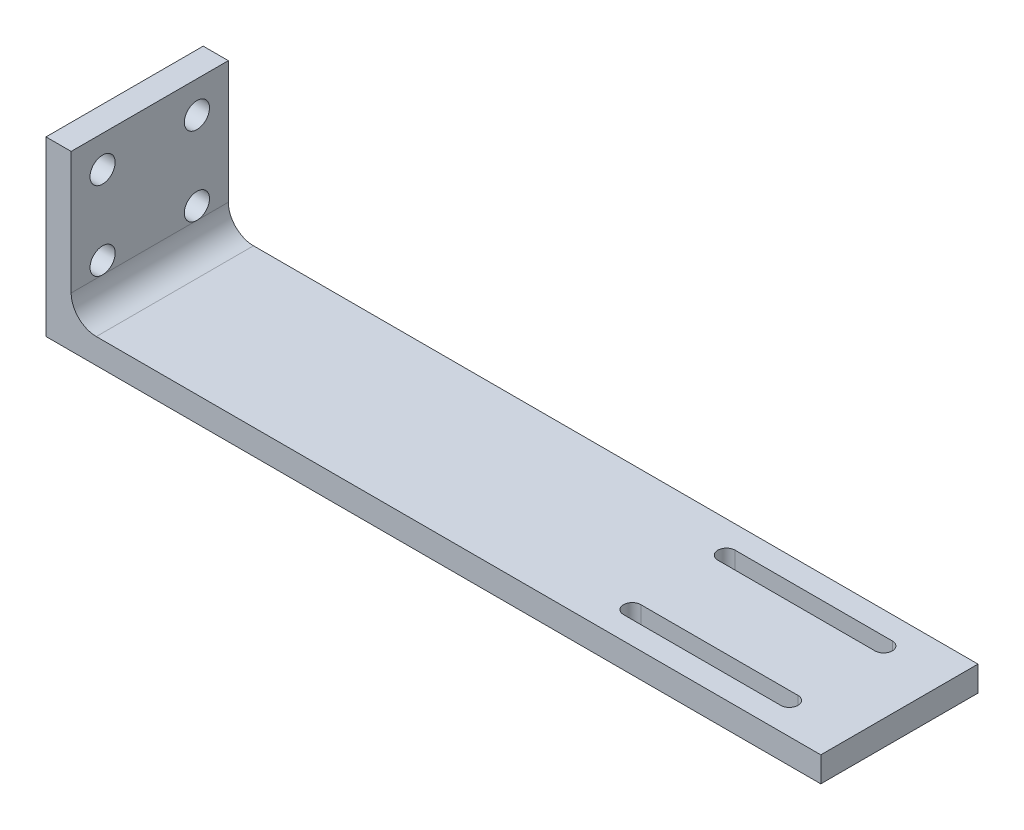
from build123d import *

# Parameters (mm, degrees)
SKETCH_1_W          = 50
SKETCH_1_H          = 55
EXTRUDE_1_DEPTH     = 8
EXTRUDE_2_DEPTH     = 8
FILLET_1_R          = 8
CUT_EXTRUDE_1_DEPTH = 8
SKETCH_4_R          = 4
CUT_EXTRUDE_2_DEPTH = 8


with BuildPart() as part:
    # 草图1 → 凸台-拉伸1 (new body)
    with BuildSketch(Plane(origin=(0, 0, 0), x_dir=(0, 0, -1), z_dir=(1, 0, 0))):
        with Locations((0, 7.5)):
            Rectangle(SKETCH_1_W, SKETCH_1_H)
    extrude(amount=EXTRUDE_1_DEPTH)

    # 草图2 → 凸台-拉伸2 (add)
    with BuildSketch(Plane.XZ.offset(20)):
        Polygon((0, 25), (8, 25), (246.45, 25), (246.45, -25), (8, -25), (0, -25), align=None)
    extrude(amount=-EXTRUDE_2_DEPTH)

    # 圆角1
    fillet_1_edges = [part.edges().sort_by_distance(p)[0] for p in [
        (8, -12, 0),
    ]]
    fillet(fillet_1_edges, radius=FILLET_1_R)

    # 草图3 → 切除-拉伸1 (cut)
    with BuildSketch(Plane.XZ.offset(20)):
        with BuildLine():
            Line((176.45, -17.75), (226.45, -17.75))
            ThreePointArc((226.45, -17.75), (229.2, -15), (226.45, -12.25))
            Line((226.45, -12.25), (176.450000009, -12.25))
            ThreePointArc((176.450000009, -12.25), (173.7, -14.999999996), (176.45, -17.75))
        make_face()
        with BuildLine():
            Line((176.449999995, 12.25), (226.45, 12.25))
            ThreePointArc((226.45, 12.25), (229.2, 15), (226.45, 17.75))
            Line((226.45, 17.75), (176.45, 17.75))
            ThreePointArc((176.45, 17.75), (173.7, 15.000000003), (176.449999995, 12.25))
        make_face()
    extrude(amount=-CUT_EXTRUDE_1_DEPTH, mode=Mode.SUBTRACT)

    # 草图4 → 切除-拉伸2 (cut)
    with BuildSketch(Plane.ZY):
        with Locations((-15, 25)):
            Circle(SKETCH_4_R)
        with Locations((-15, 0)):
            Circle(SKETCH_4_R)
        with Locations((15, 25)):
            Circle(SKETCH_4_R)
        with Locations((15, 0)):
            Circle(SKETCH_4_R)
    extrude(amount=-CUT_EXTRUDE_2_DEPTH, mode=Mode.SUBTRACT)


solid = part.part
